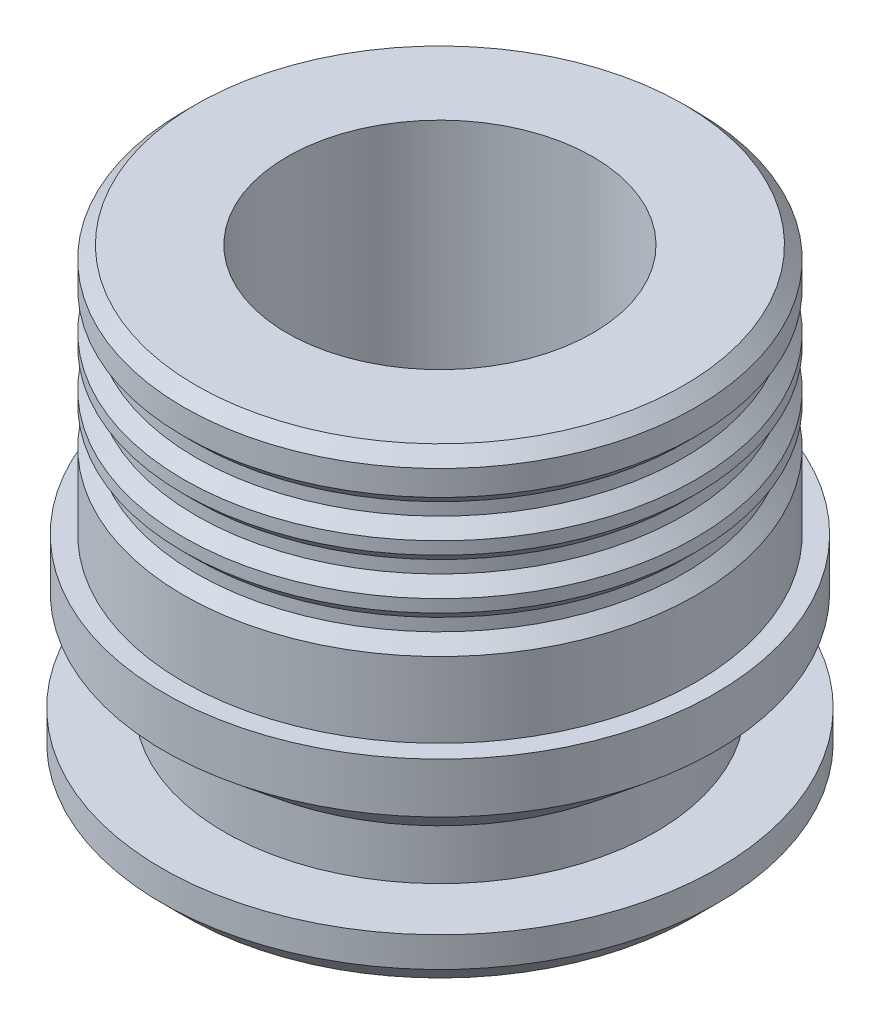
from build123d import *

# Parameters (mm, degrees)
CHAMFER_1_SIZE = 1
CHAMFER_2_SIZE = 0.5
CHAMFER_3_SIZE = 0.5


with BuildPart() as part:
    # 스케치1 → 회전1 (revolve)
    with BuildSketch(Plane(origin=(0, 0, 0), x_dir=(0, 0, -1), z_dir=(1, 0, 0))):
        Polygon((6.1, 0), (6.1, 18.2), (10.225, 18.2), (10.225, 16.7), (9.725, 16.200000049), (9.725, 15.700000049), (10.225, 15.2), (10.225, 14.7), (9.725, 14.200000049), (9.725, 13.700000049), (10.225, 13.2), (10.225, 12.7), (9.725, 12.200000049), (9.725, 11.700000049), (10.225, 11.2), (10.225, 8.2), (11, 8.2), (11, 6.2), (8.6, 4.2), (8.6, 2.2), (11.1, 2.2), (11.1, 0), align=None)
    revolve(axis=Axis((0, 0, 0), (0, 1, 0)))

    # 모따기1
    chamfer_1_edges = [part.edges().sort_by_distance(p)[0] for p in [
        (0, 0, 11.1),
    ]]
    chamfer(chamfer_1_edges, length=CHAMFER_1_SIZE)

    # 모따기2
    chamfer_2_edges = [part.edges().sort_by_distance(p)[0] for p in [
        (0, 18.2, 10.225),
    ]]
    chamfer(chamfer_2_edges, length=CHAMFER_2_SIZE)

    # 모따기3
    chamfer_3_edges = [part.edges().sort_by_distance(p)[0] for p in [
        (0, 0, 6.1),
    ]]
    chamfer(chamfer_3_edges, length=CHAMFER_3_SIZE)


solid = part.part
